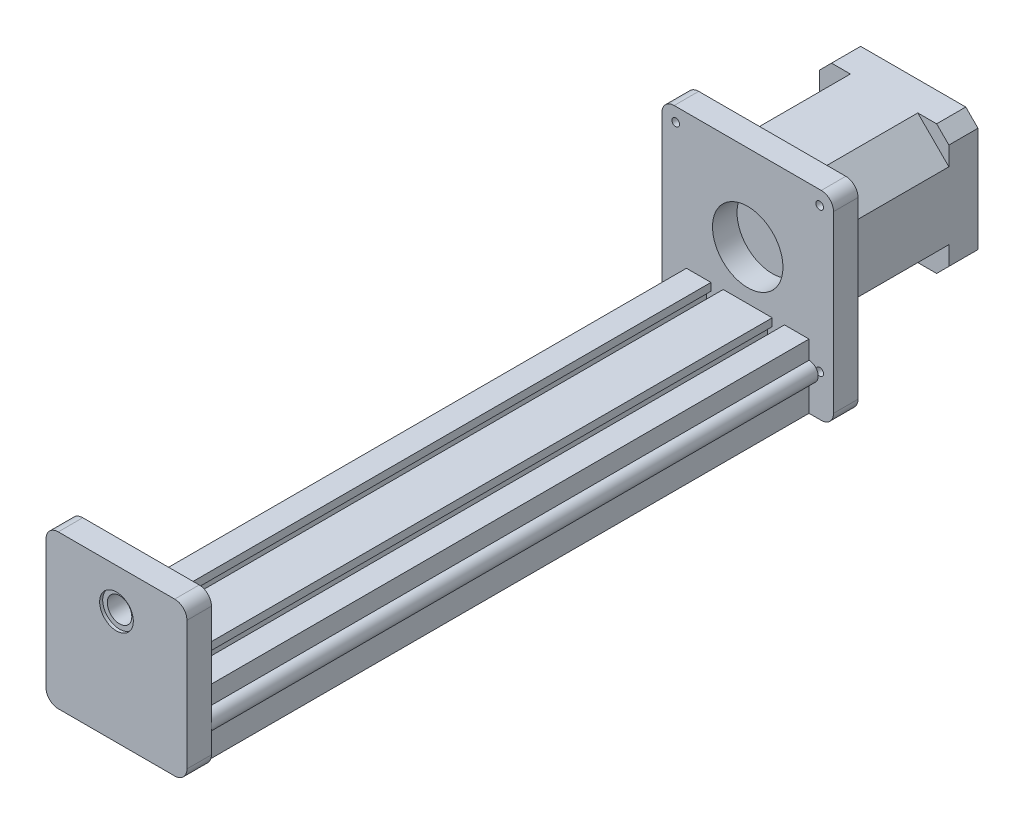
from build123d import *

# Parameters (mm, degrees)
SKETCH2_W                            = 56
SKETCH2_H                            = 65
SKETCH2_R                            = 11.5
BOSS_EXTRUDE2_DEPTH                  = 8
BOSS_EXTRUDE1_DEPTH                  = 198
SKETCH3_W                            = 46
SKETCH3_H                            = 50
SKETCH3_R                            = 5.5
BOSS_EXTRUDE3_DEPTH                  = 8
SKETCH4_R                            = 5.5
SKETCH4_R_2                          = 4
BOSS_EXTRUDE4_DEPTH                  = 6
FILLET1_R                            = 4
FILLET2_R                            = 4
SKETCH5_R                            = 3
BOSS_EXTRUDE5_DEPTH                  = 198
BOSS_EXTRUDE5_2_DEPTH                = 198
SKETCH6_W                            = 42.3
SKETCH6_H                            = 42.3
BOSS_EXTRUDE6_DEPTH                  = 6.5
BOSS_EXTRUDE7_DEPTH                  = 30
SKETCH8_W                            = 42.3
SKETCH8_H                            = 42.3
BOSS_EXTRUDE8_DEPTH                  = 9.5
CHAMFER1_SIZE                        = 4
SKETCH11_W                           = 1.25
SKETCH11_H                           = 54
TAP_DRILL_FOR_M3X0_5_TAP1_AT_2_COUNT = 2
TAP_DRILL_FOR_M3X0_5_TAP1_AT_2_PITCH = 47
TAP_DRILL_FOR_M3X0_5_TAP1_AT_3_COUNT = 2
TAP_DRILL_FOR_M3X0_5_TAP1_AT_3_PITCH = 66.468037432
TAP_DRILL_FOR_M3X0_5_TAP1_AT_4_COUNT = 2
TAP_DRILL_FOR_M3X0_5_TAP1_AT_4_PITCH = 47


with BuildPart() as part:
    # Sketch2 → Boss-Extrude2 (new body)
    with BuildSketch(Plane.XY):
        with Locations((0, 32.5)):
            Rectangle(SKETCH2_W, SKETCH2_H)
        with Locations((0, 37)):
            Circle(SKETCH2_R, mode=Mode.SUBTRACT)
    extrude(amount=-BOSS_EXTRUDE2_DEPTH)

    # Fillet1
    fillet1_edges = [part.edges().sort_by_distance(p)[0] for p in [
        (-28, 65, -4),
        (28, 65, -4),
        (28, 0, -4),
        (-28, 0, -4),
    ]]
    fillet(fillet1_edges, radius=FILLET1_R)

    # Sketch6 → Boss-Extrude6 (add)
    with BuildSketch(Plane(origin=(0, 0, -8), x_dir=(-1, 0, 0), z_dir=(0, 0, -1))):
        with Locations((0, 37)):
            Rectangle(SKETCH6_W, SKETCH6_H)
    extrude(amount=BOSS_EXTRUDE6_DEPTH)

    # Sketch7 → Boss-Extrude7 (add)
    with BuildSketch(Plane(origin=(0, 0, -14.5), x_dir=(-1, 0, 0), z_dir=(0, 0, -1))):
        Polygon((-11, 58.15), (-21.15, 48), (-21.15, 26), (-11, 15.85), (11, 15.85), (21.15, 26), (21.15, 48), (11, 58.15), align=None)
    extrude(amount=BOSS_EXTRUDE7_DEPTH)

    # Sketch8 → Boss-Extrude8 (add)
    with BuildSketch(Plane(origin=(0, 0, -44.5), x_dir=(-1, 0, 0), z_dir=(0, 0, -1))):
        with Locations((0, 37)):
            Rectangle(SKETCH8_W, SKETCH8_H)
    extrude(amount=BOSS_EXTRUDE8_DEPTH)

    # Chamfer1
    chamfer1_edges = [part.edges().sort_by_distance(p)[0] for p in [
        (-21.15, 15.85, -11.25),
        (-21.15, 58.15, -11.25),
        (21.15, 58.15, -11.25),
        (21.15, 15.85, -11.25),
        (21.15, 58.15, -49.25),
        (21.15, 15.85, -49.25),
        (-21.15, 15.85, -49.25),
        (-21.15, 58.15, -49.25),
    ]]
    chamfer(chamfer1_edges, length=CHAMFER1_SIZE)

    # Sketch11 → Tap Drill for M3x0.5 Tap1 (revolve, cut)
    with BuildSketch(Plane(origin=(23.5, 60.5, 0), x_dir=(0, -1, 0), z_dir=(1, 0, 0))):
        with Locations((0.625, 27)):
            Rectangle(SKETCH11_W, SKETCH11_H)
    tap_drill_for_m3x0_5_tap1 = revolve(axis=Axis((23.5, 60.5, 6.35), (0, 0, -1)), mode=Mode.SUBTRACT)

    # Tap Drill for M3x0.5 Tap1 at 2: Tap Drill for M3x0.5 Tap1 ×2
    with Locations(*[(-i * TAP_DRILL_FOR_M3X0_5_TAP1_AT_2_PITCH, 0, 0) for i in range(1, TAP_DRILL_FOR_M3X0_5_TAP1_AT_2_COUNT)]):
        add(tap_drill_for_m3x0_5_tap1, mode=Mode.SUBTRACT)

    # Tap Drill for M3x0.5 Tap1 at 3: Tap Drill for M3x0.5 Tap1 ×2
    with Locations(*[Vector(-0.7071067811865475, -0.7071067811865477, 0) * (i * TAP_DRILL_FOR_M3X0_5_TAP1_AT_3_PITCH) for i in range(1, TAP_DRILL_FOR_M3X0_5_TAP1_AT_3_COUNT)]):
        add(tap_drill_for_m3x0_5_tap1, mode=Mode.SUBTRACT)

    # Tap Drill for M3x0.5 Tap1 at 4: Tap Drill for M3x0.5 Tap1 ×2
    with Locations(*[(0, -i * TAP_DRILL_FOR_M3X0_5_TAP1_AT_4_PITCH, 0) for i in range(1, TAP_DRILL_FOR_M3X0_5_TAP1_AT_4_COUNT)]):
        add(tap_drill_for_m3x0_5_tap1, mode=Mode.SUBTRACT)


with BuildPart() as body_2:
    # Sketch1 → Boss-Extrude1 (new body)
    with BuildSketch(Plane.XY):
        with BuildLine():
            Line((8, 0), (-8, 0))
            Line((-8, 0), (-8, 2.5))
            Line((-8, 2.5), (-6.5, 2.5))
            Line((-6.5, 2.5), (-6.5, 6.5))
            Line((-6.5, 6.5), (-13.5, 6.5))
            Line((-13.5, 6.5), (-13.5, 2.5))
            Line((-13.5, 2.5), (-12, 2.5))
            Line((-12, 2.5), (-12, 0))
            Line((-12, 0), (-20, 0))
            Line((-20, 0), (-20, 9))
            ThreePointArc((-20, 9), (-17, 12), (-20, 15))
            Line((-20, 15), (-20, 21))
            Line((-20, 21), (-12, 21))
            Line((-12, 21), (-12, 18.5))
            Line((-12, 18.5), (-13.5, 18.5))
            Line((-13.5, 18.5), (-13.5, 14.5))
            Line((-13.5, 14.5), (-6.5, 14.5))
            Line((-6.5, 14.5), (-6.5, 18.5))
            Line((-6.5, 18.5), (-8, 18.5))
            Line((-8, 18.5), (-8, 21))
            Line((-8, 21), (8, 21))
            Line((8, 21), (8, 18.5))
            Line((8, 18.5), (6.5, 18.5))
            Line((6.5, 18.5), (6.5, 14.5))
            Line((6.5, 14.5), (13.5, 14.5))
            Line((13.5, 14.5), (13.5, 18.5))
            Line((13.5, 18.5), (12, 18.5))
            Line((12, 18.5), (12, 21))
            Line((12, 21), (20, 21))
            Line((20, 21), (20, 15))
            ThreePointArc((20, 15), (17, 12), (20, 9))
            Line((20, 9), (20, 0))
            Line((20, 0), (12, 0))
            Line((12, 0), (12, 2.5))
            Line((12, 2.5), (13.5, 2.5))
            Line((13.5, 2.5), (13.5, 6.5))
            Line((13.5, 6.5), (6.5, 6.5))
            Line((6.5, 6.5), (6.5, 2.5))
            Line((6.5, 2.5), (8, 2.5))
            Line((8, 2.5), (8, 0))
        make_face()
    extrude(amount=BOSS_EXTRUDE1_DEPTH)


with BuildPart() as body_3:
    # Sketch3 → Boss-Extrude3 (new body)
    with BuildSketch(Plane.XY.offset(198)):
        with Locations((0, 25)):
            Rectangle(SKETCH3_W, SKETCH3_H)
        with Locations((0, 37)):
            Circle(SKETCH3_R, mode=Mode.SUBTRACT)
    extrude(amount=BOSS_EXTRUDE3_DEPTH)

    # Fillet2
    fillet2_edges = [body_3.edges().sort_by_distance(p)[0] for p in [
        (-23, 50, 202),
        (23, 50, 202),
        (23, 0, 202),
        (-23, 0, 202),
    ]]
    fillet(fillet2_edges, radius=FILLET2_R)


with BuildPart() as body_4:
    # Sketch4 → Boss-Extrude4 (new body)
    with BuildSketch(Plane.XY.offset(205)):
        with Locations((0, 37)):
            Circle(SKETCH4_R)
        with Locations((0, 37)):
            Circle(SKETCH4_R_2, mode=Mode.SUBTRACT)
    extrude(amount=-BOSS_EXTRUDE4_DEPTH)


with BuildPart() as body_5:
    # Sketch5 → Boss-Extrude5 (new body)
    with BuildSketch(Plane.XY):
        with Locations(Location((-20, 12, 0), (0, 0, 180))):
            Circle(SKETCH5_R)
    extrude(amount=BOSS_EXTRUDE5_DEPTH)


with BuildPart() as body_6:
    # Sketch5 → Boss-Extrude5 2 (new body)
    with BuildSketch(Plane.XY):
        with Locations(Location((20, 12, 0), (0, 0, 180))):
            Circle(SKETCH5_R)
    extrude(amount=BOSS_EXTRUDE5_2_DEPTH)


solid = Compound([part.part, body_2.part, body_3.part, body_4.part, body_5.part, body_6.part])
